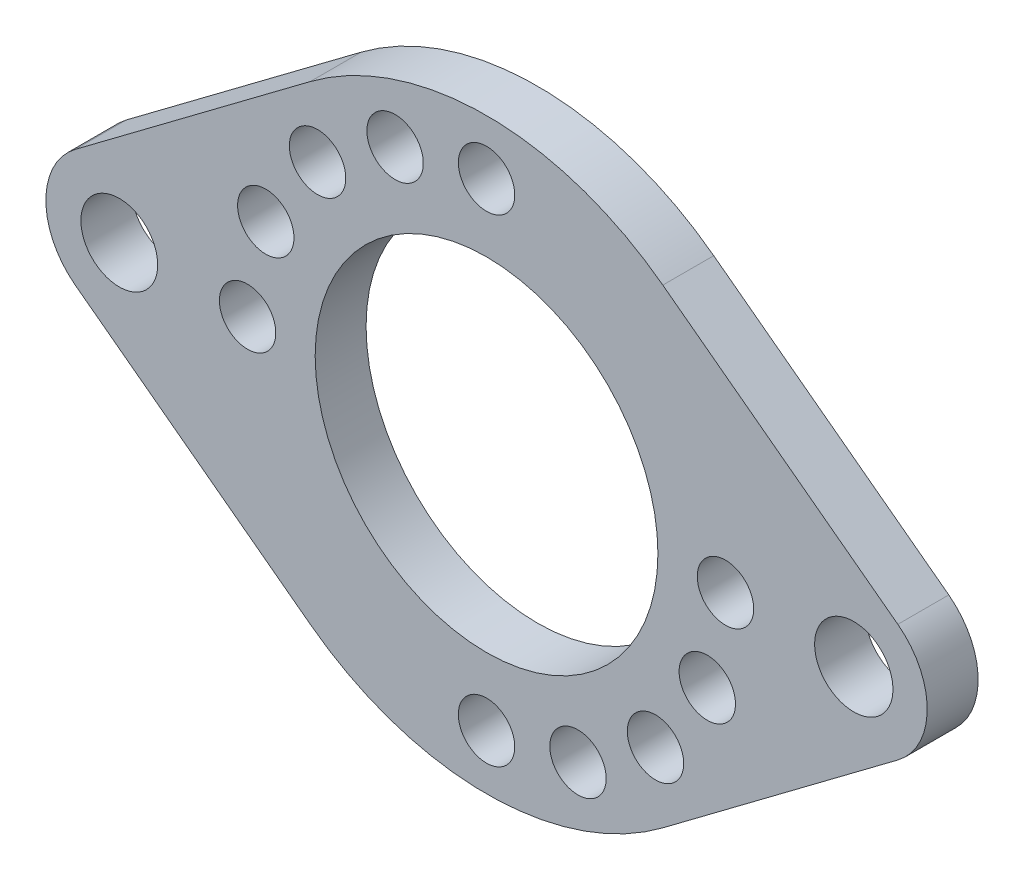
from build123d import *

# Parameters (mm, degrees)
SKETCH1_R           = 11.112500335
SKETCH1_R_2         = 1.828800055
SKETCH1_R_3         = 2.489200075
SKETCH1_R_4         = 2.540000076
BOSS_EXTRUDE1_DEPTH = 3.302


with BuildPart() as part:
    # Sketch1 → Boss-Extrude1 (new body)
    with BuildSketch(Plane.XY):
        with BuildLine():
            Line((-26.670000803, -3.810000115), (-11.430000344, -15.240000459))
            ThreePointArc((-11.430000344, -15.240000459), (0, -19.050000574), (11.430000344, -15.240000459))
            Line((11.430000344, -15.240000459), (26.670000803, -3.810000115))
            ThreePointArc((26.670000803, -3.810000115), (28.57500086, 0), (26.670000803, 3.810000115))
            Line((26.670000803, 3.810000115), (11.430000344, 15.240000459))
            ThreePointArc((11.430000344, 15.240000459), (0, 19.050000574), (-11.430000344, 15.240000459))
            Line((-11.430000344, 15.240000459), (-26.670000803, 3.810000115))
            ThreePointArc((-26.670000803, 3.810000115), (-28.57500086, 0), (-26.670000803, -3.810000115))
        make_face()
        with Locations(Location((0, 0, 0), (0, 0, 180))):
            Circle(SKETCH1_R, mode=Mode.SUBTRACT)
        with Locations(Location((0, 15.494000466, 0), (0, 0, 180))):
            Circle(SKETCH1_R_2, mode=Mode.SUBTRACT)
        with Locations(Location((-15.494000466, 0, 0), (0, 0, 180))):
            Circle(SKETCH1_R_2, mode=Mode.SUBTRACT)
        with Locations(Location((-14.314589908, 5.92929728, 0), (0, 0, 180))):
            Circle(SKETCH1_R_2, mode=Mode.SUBTRACT)
        with Locations(Location((-5.92929728, 14.314589908, 0), (0, 0, 180))):
            Circle(SKETCH1_R_2, mode=Mode.SUBTRACT)
        with Locations(Location((-10.955912798, 10.955912798, 0), (0, 0, 180))):
            Circle(SKETCH1_R_2, mode=Mode.SUBTRACT)
        with Locations(Location((0, -15.494000466, 0), (0, 0, 180))):
            Circle(SKETCH1_R_2, mode=Mode.SUBTRACT)
        with Locations(Location((15.494000466, 0, 0), (0, 0, 180))):
            Circle(SKETCH1_R_2, mode=Mode.SUBTRACT)
        with Locations(Location((14.314589908, -5.92929728, 0), (0, 0, 180))):
            Circle(SKETCH1_R_2, mode=Mode.SUBTRACT)
        with Locations(Location((5.92929728, -14.314589908, 0), (0, 0, 180))):
            Circle(SKETCH1_R_2, mode=Mode.SUBTRACT)
        with Locations(Location((10.955912798, -10.955912798, 0), (0, 0, 180))):
            Circle(SKETCH1_R_2, mode=Mode.SUBTRACT)
        with Locations(Location((-23.812500717, 0, 0), (0, 0, 180))):
            Circle(SKETCH1_R_3, mode=Mode.SUBTRACT)
        with Locations(Location((23.812500717, 0, 0), (0, 0, 180))):
            Circle(SKETCH1_R_4, mode=Mode.SUBTRACT)
    extrude(amount=BOSS_EXTRUDE1_DEPTH)


solid = part.part
